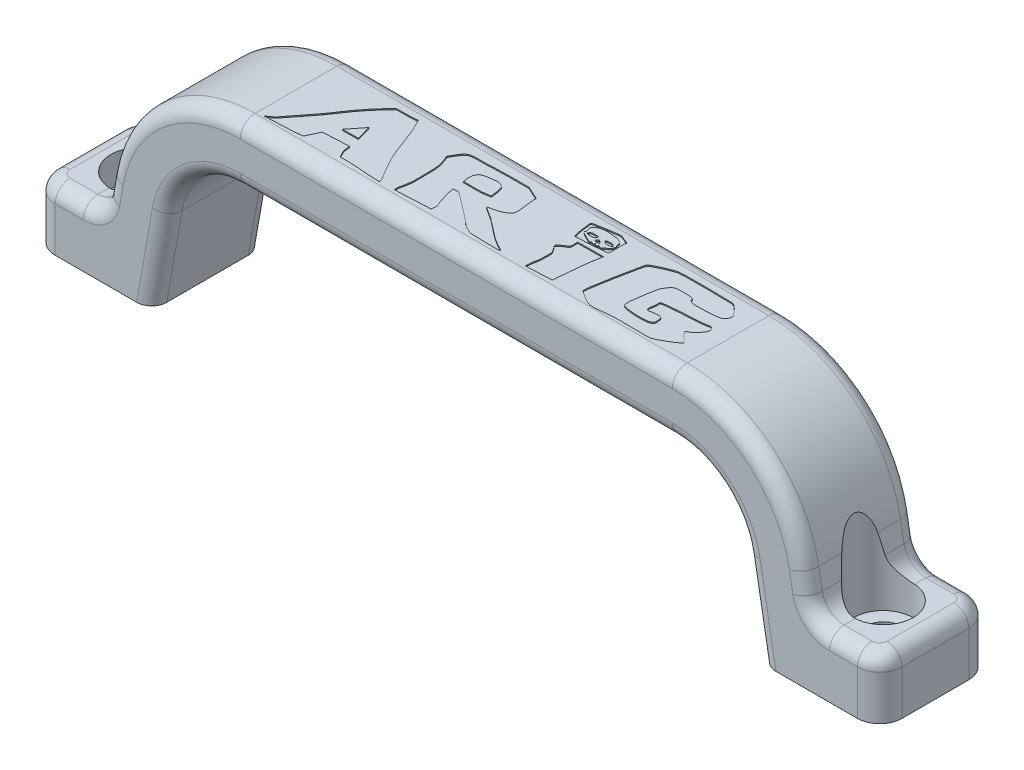
from build123d import *

# Parameters (mm, degrees)
EXTRU_MINCE1_DEPTH                           = 7.5
CONG_1_R                                     = 3
CONG_2_R                                     = 2
CHAMBRAGE_POUR_VIS_T_TE_CYLINDRIQUE_AT_COUNT = 2
CHAMBRAGE_POUR_VIS_T_TE_CYLINDRIQUE_AT_PITCH = 100
ENL_V_MAT_EXTRU_1_DEPTH                      = 0.15


with BuildPart() as part:
    # Esquisse1 → Extru.-Mince1 (new, symmetric)
    with BuildSketch(Plane.XY):
        with BuildLine():
            Line((-57, 0), (-41, 0))
            Line((-41, 0), (-38.930541604, 11.736481777))
            ThreePointArc((-38.930541604, 11.736481777), (-35.510340171, 17.660444431), (-29.082464074, 20))
            Line((-29.082464074, 20), (29.082464074, 20))
            ThreePointArc((29.082464074, 20), (35.510340171, 17.660444431), (38.930541604, 11.736481777))
            Line((38.930541604, 11.736481777), (41, 0))
            Line((41, 0), (57, 0))
            Line((57, 0), (57, 8))
            Line((57, 8), (47.712797049, 8))
            Line((47.712797049, 8), (46.809003628, 13.125667198))
            ThreePointArc((46.809003628, 13.125667198), (40.652641048, 23.788799976), (29.082464074, 28))
            Line((29.082464074, 28), (-29.082464074, 28))
            ThreePointArc((-29.082464074, 28), (-40.652641048, 23.788799976), (-46.809003628, 13.125667198))
            Line((-46.809003628, 13.125667198), (-47.712797049, 8))
            Line((-47.712797049, 8), (-57, 8))
            Line((-57, 8), (-57, 0))
        make_face()
    extrude(amount=EXTRU_MINCE1_DEPTH, both=True)

    # Congé1
    cong_1_edges = [part.edges().sort_by_distance(p)[0] for p in [
        (57, 4, -7.5),
        (-57, 4, -7.5),
        (-47.712797049, 8, 0),
        (47.712797049, 8, 0),
        (57, 4, 7.5),
        (-57, 4, 7.5),
    ]]
    fillet(cong_1_edges, radius=CONG_1_R)

    # Congé2
    cong_2_edges = [part.edges().sort_by_distance(p)[0] for p in [
        (-47.042338156, 11.802361333, -7.5),
        (-40.652641048, 23.788799976, -7.5),
        (0, 28, -7.5),
        (40.652641048, 23.788799976, -7.5),
        (-39.965270802, 5.868240888, 7.5),
        (39.965270802, 5.868240888, -7.5),
        (35.510340171, 17.660444431, -7.5),
        (0, 20, -7.5),
        (-35.510340171, 17.660444431, -7.5),
        (-39.965270802, 5.868240888, -7.5),
        (-35.510340171, 17.660444431, 7.5),
        (0, 20, 7.5),
        (35.510340171, 17.660444431, 7.5),
        (39.965270802, 5.868240888, 7.5),
        (40.652641048, 23.788799976, 7.5),
        (-52.115047971, 8, -7.5),
        (47.042338156, 11.802361333, -7.5),
        (52.115047971, 8, -7.5),
        (0, 28, 7.5),
        (57, 8, 0),
        (-40.652641048, 23.788799976, 7.5),
        (52.115047971, 8, 7.5),
        (56.121320344, 8, 6.621320344),
        (56.121320344, 8, -6.621320344),
        (-47.042338156, 11.802361333, 7.5),
        (-52.115047971, 8, 7.5),
        (47.042338156, 11.802361333, 7.5),
        (-57, 8, 0),
        (-56.121320344, 8, 6.621320344),
        (-56.121320344, 8, -6.621320344),
        (48.301733114, 8.701866671, -7.5),
        (48.301733114, 8.701866671, 7.5),
        (-48.301733114, 8.701866671, -7.5),
        (-48.301733114, 8.701866671, 7.5),
    ]]
    fillet(cong_2_edges, radius=CONG_2_R)

    # Esquisse4 → Chambrage pour vis à tête cylindrique à 6 pans creux (ou vis CHC) M41 (revolve, cut)
    with BuildSketch(Plane(origin=(-50, 8, 0), x_dir=(0, 0, 1), z_dir=(1, 0, 0))):
        Polygon((0, 0), (0, 8), (2.15, 8), (2.15, 4), (4, 4), (4, 0), (4, -20), (0, -20), align=None)
    chambrage_pour_vis_t_te_cylindrique = revolve(axis=Axis((-50, 14.35, 0), (0, -1, 0)), mode=Mode.SUBTRACT)

    # Chambrage pour vis à tête cylindrique à 6 pans creux (ou vis CHC) M41 at: Chambrage pour vis à tête cylindrique à 6 pans creux (ou vis CHC) M41 ×2
    with Locations(*[(i * CHAMBRAGE_POUR_VIS_T_TE_CYLINDRIQUE_AT_PITCH, 0, 0) for i in range(1, CHAMBRAGE_POUR_VIS_T_TE_CYLINDRIQUE_AT_COUNT)]):
        add(chambrage_pour_vis_t_te_cylindrique, mode=Mode.SUBTRACT)

    # Esquisse5 → Enlèv. mat.-Extru.1 (cut)
    # profile 1 of 8: a face of its own
    with BuildSketch(Plane(origin=(0, 28, 0), x_dir=(1, 0, 0), z_dir=(0, 1, 0))):
        with BuildLine():
            Line((-18.889000502, -2.985350745), (-22.376360288, -3.161141805))
            add(Edge.make_bspline(
                [(-22.376360288, -3.161141805), (-22.565625759, -3.549526321), (-22.776041372, -3.980343935), (-22.989652482, -4.455007498), (-23.04199279, -4.566720493), (-23.0850041, -4.661830805), (-23.120903649, -4.739872839), (-23.148036624, -4.800508414), (-23.17080172, -4.846101774), (-23.182038656, -4.872014531), (-23.186673363, -4.883894191)],
                knots=[0, 0, 0, 0, 0.680866466, 0.755242837, 0.820159886, 0.875250847, 0.919716623, 0.955522374, 0.979907426, 1, 1, 1, 1], degree=3))
            add(Edge.make_bspline(
                [(-23.186673363, -4.883894191), (-23.198861764, -4.88618144), (-23.227460591, -4.889107877), (-23.277705453, -4.896277084), (-23.343919737, -4.907097592), (-23.428436847, -4.91765227), (-23.531962497, -4.934092105), (-23.654456265, -4.949431501), (-23.840397148, -4.9772533), (-24.079565436, -5.00765737), (-24.448479708, -5.039071283), (-24.719360216, -5.054687273), (-24.896032145, -5.052988448)],
                knots=[0, 0, 0, 0, 0.021623909, 0.05012945, 0.088551735, 0.138677592, 0.19871818, 0.271429204, 0.354052996, 0.526763296, 0.691970711, 1, 1, 1, 1], degree=3))
            add(Edge.make_bspline(
                [(-24.896032145, -5.052988448), (-24.99927661, -5.05412406), (-25.16843858, -5.055868841), (-25.412805009, -5.065206566), (-25.638874799, -5.072843474), (-25.892737565, -5.085417568), (-26.17517873, -5.098165468), (-26.485405173, -5.115532657), (-26.812442031, -5.133190284), (-27.131123786, -5.150619117), (-27.417908194, -5.16787577), (-27.660109981, -5.181313798), (-27.858259626, -5.191200289), (-28.012322667, -5.198984075), (-28.129981574, -5.207305322), (-28.196501152, -5.209387023), (-28.226017077, -5.212037502)],
                knots=[0, 0, 0, 0, 0.092911413, 0.152199614, 0.220036878, 0.296445175, 0.380902634, 0.474438159, 0.576023544, 0.675603345, 0.761618374, 0.834541433, 0.89387215, 0.940138491, 0.973341463, 1, 1, 1, 1], degree=3))
            add(Edge.make_bspline(
                [(-28.226017077, -5.212037502), (-28.084104228, -5.126243217), (-27.880770234, -4.993968158), (-27.625169539, -4.809475629), (-27.456898151, -4.671894814), (-27.302747901, -4.536139114), (-27.166389152, -4.399171252), (-27.043710789, -4.263258786), (-26.903678064, -4.076487785), (-26.73406485, -3.836934967), (-26.435935045, -3.441472898), (-26.197088808, -3.145780455), (-26.032814331, -2.945169931)],
                knots=[0, 0, 0, 0, 0.156250484, 0.228517648, 0.296937377, 0.361008631, 0.421996837, 0.478992725, 0.53337618, 0.641834957, 0.755643392, 1, 1, 1, 1], degree=3))
            add(Edge.make_bspline(
                [(-26.032814331, -2.945169931), (-25.576080015, -2.391018303), (-24.911636831, -1.542011065), (-24.073936806, -0.373037195), (-23.573153724, 0.375322842), (-23.175994991, 0.977555252), (-22.86118328, 1.419690235), (-22.536729869, 1.855639722), (-22.203764498, 2.287110108), (-21.857996734, 2.710718389), (-21.382986603, 3.269269181), (-21.009905865, 3.67510356), (-20.757408338, 3.94249121)],
                knots=[0, 0, 0, 0, 0.248040936, 0.372250335, 0.496660753, 0.559052203, 0.62141506, 0.684102398, 0.746758016, 0.809648928, 0.872959115, 1, 1, 1, 1], degree=3))
            Line((-20.757408338, 3.94249121), (-20.161392935, 4.568642223))
            add(Edge.make_bspline(
                [(-20.161392935, 4.568642223), (-19.955451301, 4.566805976), (-19.621742428, 4.571775301), (-19.143475211, 4.575328653), (-18.726556757, 4.579363262), (-18.308528829, 4.589187745), (-17.826232066, 4.605914999), (-17.489194558, 4.633626348), (-17.281767956, 4.659049054)],
                knots=[0, 0, 0, 0, 0.214327974, 0.34734057, 0.497782751, 0.648255201, 0.782526155, 1, 1, 1, 1], degree=3))
            add(Edge.make_bspline(
                [(-17.281767956, 4.659049054), (-17.134949628, 4.393109456), (-16.91872931, 3.985901788), (-16.652834934, 3.423622362), (-16.45303627, 2.984506426), (-16.261320087, 2.530085326), (-16.072800605, 2.062932493), (-15.893093954, 1.580368816), (-15.718592326, 1.091178203), (-15.550147368, 0.609047261), (-15.381012558, 0.150831027), (-15.216067031, -0.277592451), (-15.052770633, -0.67577163), (-14.894620185, -1.044303975), (-14.697935731, -1.48006666), (-14.540010862, -1.785646), (-14.435626988, -1.979156203)],
                knots=[0, 0, 0, 0, 0.126040248, 0.191178203, 0.25801108, 0.326168609, 0.395773161, 0.466985195, 0.539776951, 0.611245197, 0.678854338, 0.742401129, 0.801689367, 0.857382442, 0.90877165, 1, 1, 1, 1], degree=3))
            add(Edge.make_bspline(
                [(-14.435626988, -1.979156203), (-14.060714152, -2.690732887), (-13.601110971, -3.46118765), (-13.093789638, -4.295915495), (-12.974550315, -4.503343512), (-12.880354646, -4.679202915), (-12.809833429, -4.82244348), (-12.766212787, -4.936621738), (-12.744331027, -5.029574258), (-12.7524512, -5.096469144), (-12.79323623, -5.098191863)],
                knots=[0, 0, 0, 0, 0.673145369, 0.751124796, 0.817898028, 0.873508092, 0.918030393, 0.951887101, 0.974708939, 1, 1, 1, 1], degree=3))
            add(Edge.make_bspline(
                [(-12.79323623, -5.098191863), (-12.846717709, -5.102791423), (-12.9416692, -5.101553031), (-13.087370306, -5.100362786), (-13.24025565, -5.094367844), (-13.422743659, -5.087855253), (-13.634850117, -5.07977698), (-13.876496627, -5.067919981), (-14.138710986, -5.052561348), (-14.405594289, -5.039085897), (-14.659457131, -5.021814653), (-14.892738065, -5.00517704), (-15.104830422, -4.988654402), (-15.296230366, -4.971686682), (-15.509841406, -4.951819794), (-15.65912897, -4.931158059), (-15.751548636, -4.917378202)],
                knots=[0, 0, 0, 0, 0.054222972, 0.096001359, 0.147400702, 0.208974939, 0.28072468, 0.362111732, 0.453705198, 0.546425989, 0.632418718, 0.711089977, 0.783006086, 0.847608632, 0.905465865, 1, 1, 1, 1], degree=3))
            add(Edge.make_bspline(
                [(-15.751548636, -4.917378202), (-15.841680449, -4.905421272), (-15.98562493, -4.891003038), (-16.188989069, -4.87646378), (-16.36699633, -4.866115105), (-16.562932828, -4.859496313), (-16.776163347, -4.857440088), (-17.006624055, -4.852668912), (-17.245496295, -4.853980892), (-17.47708963, -4.853942789), (-17.684698568, -4.853022364), (-17.860478285, -4.855917477), (-18.004464975, -4.855341731), (-18.116635899, -4.855448082), (-18.202020217, -4.855429658), (-18.25001395, -4.855433192), (-18.271220492, -4.855432781)],
                knots=[0, 0, 0, 0, 0.108137987, 0.17203399, 0.242511649, 0.320224082, 0.40520354, 0.496156706, 0.594402213, 0.689328615, 0.771642418, 0.841346783, 0.898435388, 0.942911395, 0.974774802, 1, 1, 1, 1], degree=3))
            add(Edge.make_bspline(
                [(-18.271220492, -4.855432781), (-18.278027736, -4.844649758), (-18.290567753, -4.819615634), (-18.314441824, -4.776018784), (-18.346489114, -4.71953322), (-18.386248728, -4.645328967), (-18.43650014, -4.55580176), (-18.495267105, -4.449861109), (-18.582078765, -4.292743887), (-18.68158196, -4.097085998), (-18.791714108, -3.817167413), (-18.82814295, -3.610495481), (-18.822032479, -3.482588314)],
                knots=[0, 0, 0, 0, 0.025534032, 0.056060285, 0.099620315, 0.155674132, 0.224761645, 0.305363743, 0.398459664, 0.584520463, 0.744872781, 1, 1, 1, 1], degree=3))
            add(Edge.make_bspline(
                [(-18.822032479, -3.482588314), (-18.820973275, -3.417333622), (-18.843820609, -3.251240918), (-18.867028843, -3.0855507), (-18.889000502, -2.985350745)],
                knots=[0, 0, 0, 0, 0.388377336, 1, 1, 1, 1], degree=3))
        make_face()
        with BuildLine():
            Line((-21.341704336, -1.465176628), (-19.227189017, -1.443412021))
            add(Edge.make_bspline(
                [(-19.227189017, -1.443412021), (-19.321779754, -1.071084197), (-19.441619334, -0.613903941), (-19.596246753, -0.085688012), (-19.676193266, 0.194654727), (-19.738523082, 0.38810815), (-19.778001005, 0.507031642)],
                knots=[0, 0, 0, 0, 0.568584025, 0.699276774, 0.81454122, 1, 1, 1, 1], degree=3))
            add(Edge.make_bspline(
                [(-19.778001005, 0.507031642), (-19.938000901, 0.309121276), (-20.168990568, 0.018996939), (-20.467823651, -0.355697696), (-20.671043317, -0.61022718), (-20.858311275, -0.848596899), (-21.081607435, -1.130607423), (-21.239208658, -1.335872481), (-21.341704336, -1.465176628)],
                knots=[0, 0, 0, 0, 0.303339354, 0.44202356, 0.571254616, 0.691554213, 0.803335608, 1, 1, 1, 1], degree=3))
        make_face(mode=Mode.SUBTRACT)
    # profile 2 of 8: a face of its own
    with BuildSketch(Plane(origin=(0, 28, 0), x_dir=(1, 0, 0), z_dir=(0, 1, 0))):
        with BuildLine():
            Line((-2.003683241, 4.314163737), (-0.215637033, 3.495479658))
            add(Edge.make_bspline(
                [(-0.215637033, 3.495479658), (-0.242645561, 3.410362138), (-0.253650223, 3.260734699), (-0.242239394, 3.040051999), (-0.205023193, 2.750428367), (-0.143755054, 2.354227592), (-0.078794271, 1.860419693), (-0.021328557, 1.364768653), (0.004380791, 0.963938143), (0.006318116, 0.669983637), (-0.017925261, 0.441928992), (-0.070217426, 0.291457638), (-0.125230203, 0.212372342)],
                knots=[0, 0, 0, 0, 0.079958746, 0.134412926, 0.199323326, 0.343348876, 0.496285098, 0.648796927, 0.793602404, 0.858577257, 0.913865917, 1, 1, 1, 1], degree=3))
            add(Edge.make_bspline(
                [(-0.125230203, 0.212372342), (-0.172462729, 0.147825454), (-0.256546762, 0.055919836), (-0.388602041, -0.051689738), (-0.504620223, -0.130197259), (-0.630714979, -0.209589541), (-0.772789325, -0.282962684), (-0.927909153, -0.352571038), (-1.153706025, -0.442234621), (-1.453395941, -0.545444724), (-1.964598352, -0.694803382), (-2.361852392, -0.783284359), (-2.633182655, -0.832328813)],
                knots=[0, 0, 0, 0, 0.086643666, 0.134367777, 0.184384294, 0.238452904, 0.295829646, 0.357573776, 0.422742128, 0.559179035, 0.701056708, 1, 1, 1, 1], degree=3))
            add(Edge.make_bspline(
                [(-2.633182655, -0.832328813), (-2.355731393, -0.991138943), (-1.946857331, -1.236333821), (-1.416494635, -1.579430382), (-1.033222794, -1.842948955), (-0.659738995, -2.110797867), (-0.296094575, -2.383269999), (0.056265765, -2.662906296), (0.396242371, -2.951788782), (0.738098315, -3.238266406), (1.093770146, -3.512325833), (1.461451409, -3.77848014), (1.842274178, -4.034438587), (2.234473284, -4.282775799), (2.777997858, -4.603961922), (3.199601867, -4.826954999), (3.486020425, -4.96927842)],
                knots=[0, 0, 0, 0, 0.129562826, 0.193176436, 0.255974622, 0.318051402, 0.379435805, 0.440120776, 0.500326732, 0.5602431, 0.620865236, 0.682259223, 0.744174686, 0.806797486, 0.870374094, 1, 1, 1, 1], degree=3))
            add(Edge.make_bspline(
                [(3.486020425, -4.96927842), (3.428753262, -4.993837788), (3.325339329, -5.019667503), (3.16770825, -5.038242518), (3.009565529, -5.049060828), (2.824255953, -5.058240697), (2.611523283, -5.057998515), (2.371494059, -5.057742268), (2.105910939, -5.047468209), (1.817966225, -5.037783024), (1.512174334, -5.027172755), (1.189577323, -5.01940673), (0.850833909, -5.010926656), (0.494787171, -5.002534928), (-0.01248366, -4.99130861), (-0.401439124, -4.982536856), (-0.665996986, -4.979323623)],
                knots=[0, 0, 0, 0, 0.044780014, 0.076413176, 0.114330404, 0.159026646, 0.210115369, 0.26764009, 0.33203326, 0.401666244, 0.475319553, 0.552579838, 0.634263575, 0.71956661, 0.809293345, 1, 1, 1, 1], degree=3))
            add(Edge.make_bspline(
                [(-0.665996986, -4.979323623), (-0.677902774, -4.972947866), (-0.70650434, -4.961628708), (-0.756087043, -4.93733398), (-0.822498977, -4.908425409), (-0.907229069, -4.869142038), (-1.009864595, -4.820392413), (-1.132984149, -4.765990274), (-1.26835005, -4.702395571), (-1.407253763, -4.637542789), (-1.536584612, -4.570096197), (-1.652377655, -4.505085498), (-1.754669507, -4.441507201), (-1.843672016, -4.380342599), (-1.937032783, -4.304141725), (-1.996253372, -4.24361585), (-2.027122049, -4.200820358)],
                knots=[0, 0, 0, 0, 0.02560566, 0.05830671, 0.104770837, 0.163070344, 0.235575693, 0.320438053, 0.418541203, 0.519463335, 0.611377807, 0.695336218, 0.771465269, 0.839935133, 0.900156543, 1, 1, 1, 1], degree=3))
            add(Edge.make_bspline(
                [(-2.027122049, -4.200820358), (-2.045918494, -4.178997931), (-2.079379926, -4.140840573), (-2.138353121, -4.090496062), (-2.198379267, -4.036684576), (-2.269609937, -3.972614952), (-2.356358376, -3.902775413), (-2.454241957, -3.822567827), (-2.605292234, -3.701921825), (-2.810071983, -3.536966065), (-3.075369779, -3.329772431), (-3.361544105, -3.106956272), (-3.776323554, -2.787186736), (-4.321775113, -2.369299651), (-4.881399603, -1.953168805), (-5.326923041, -1.621560415), (-5.729329419, -1.3172602), (-6.025047825, -1.104043184), (-6.210949272, -0.962916457)],
                knots=[0, 0, 0, 0, 0.016345481, 0.028665675, 0.043901598, 0.062053437, 0.082952022, 0.107010959, 0.133786167, 0.192523562, 0.256055589, 0.324580745, 0.398100161, 0.552912195, 0.714045099, 0.793378036, 0.867712912, 1, 1, 1, 1], degree=3))
            add(Edge.make_bspline(
                [(-6.210949272, -0.962916457), (-6.593840623, -0.972017884), (-6.976058932, -0.996400469)],
                knots=[0, 0, 0, 1, 1, 1], degree=2))
            add(Edge.make_bspline(
                [(-6.976058932, -0.996400469), (-6.923676683, -1.241695084), (-6.837373659, -1.626375055), (-6.693401156, -2.157160378), (-6.59368103, -2.519572534), (-6.508262889, -2.809468621), (-6.446388593, -3.00800643), (-6.389607825, -3.183861108), (-6.337829799, -3.337028612), (-6.29007465, -3.467465893), (-6.235812304, -3.59590063), (-6.195373901, -3.679795432), (-6.165745856, -3.725347397)],
                knots=[0, 0, 0, 0, 0.263801582, 0.414408358, 0.578294401, 0.659070143, 0.732204151, 0.796974333, 0.853392196, 0.902228584, 0.942993102, 1, 1, 1, 1], degree=3))
            add(Edge.make_bspline(
                [(-6.165745856, -3.725347397), (-6.104841856, -3.814269448), (-6.050517533, -3.973780142), (-6.025963142, -4.205017551), (-6.03822307, -4.361880313), (-6.050950421, -4.486648565), (-6.062165315, -4.569560848), (-6.067851453, -4.640658692), (-6.074693191, -4.698628225), (-6.080510095, -4.743735733), (-6.08210731, -4.778080998), (-6.087831477, -4.796661064), (-6.08705843, -4.805206764)],
                knots=[0, 0, 0, 0, 0.288847176, 0.450004935, 0.627168978, 0.713842629, 0.789996859, 0.853798141, 0.907070913, 0.948152535, 0.977043752, 1, 1, 1, 1], degree=3))
            add(Edge.make_bspline(
                [(-6.08705843, -4.805206764), (-6.099892989, -4.805263202), (-6.129488472, -4.804764508), (-6.181916752, -4.807425717), (-6.251128021, -4.808652456), (-6.339301531, -4.810404067), (-6.447566336, -4.812128074), (-6.575381471, -4.813303862), (-6.768469016, -4.818263485), (-7.011833295, -4.82445492), (-7.368964692, -4.837926889), (-7.624405065, -4.860563701), (-7.786372007, -4.878871589)],
                knots=[0, 0, 0, 0, 0.022629069, 0.05216164, 0.092512413, 0.144666941, 0.207642473, 0.28340705, 0.370010196, 0.548159068, 0.712610067, 1, 1, 1, 1], degree=3))
            add(Edge.make_bspline(
                [(-7.786372007, -4.878871589), (-7.877175647, -4.889390604), (-8.024483649, -4.903243761), (-8.235554594, -4.919883926), (-8.426434467, -4.933028382), (-8.638999019, -4.947062129), (-8.873526358, -4.957335186), (-9.129549823, -4.972278133), (-9.398654798, -4.982028631), (-9.663644564, -4.994940262), (-9.907066411, -5.00165973), (-10.120714213, -5.011536358), (-10.304919573, -5.015961848), (-10.459502444, -5.019517993), (-10.606280769, -5.021586093), (-10.701179478, -5.02168551), (-10.754729617, -5.019504437)],
                knots=[0, 0, 0, 0, 0.092244756, 0.149305596, 0.213667706, 0.285335221, 0.364280999, 0.450567525, 0.544140957, 0.636026333, 0.718300987, 0.789882146, 0.851856616, 0.904245849, 0.945926074, 1, 1, 1, 1], degree=3))
            add(Edge.make_bspline(
                [(-10.754729617, -5.019504437), (-10.793687745, -5.018544082), (-10.83361451, -4.965453672), (-10.85216044, -4.871033306), (-10.85544645, -4.763171373), (-10.845319364, -4.625686994), (-10.825236126, -4.458519001), (-10.790624976, -4.261522518), (-10.744512468, -4.042686549), (-10.694591845, -3.815632725), (-10.651152469, -3.59457601), (-10.614499462, -3.388025877), (-10.583843881, -3.196086144), (-10.56023359, -3.018573172), (-10.538774618, -2.810565067), (-10.530495985, -2.661275821), (-10.53038674, -2.566800603)],
                knots=[0, 0, 0, 0, 0.040959665, 0.071715244, 0.114252125, 0.168793839, 0.235661122, 0.314465282, 0.406650774, 0.501708187, 0.591028112, 0.67463858, 0.751261936, 0.822247522, 0.887648532, 1, 1, 1, 1], degree=3))
            add(Edge.make_bspline(
                [(-10.53038674, -2.566800603), (-10.542925443, -2.138277151), (-10.551851525, -1.509323921), (-10.564649317, -0.688367667), (-10.559941923, -0.201094049), (-10.570824166, 0.184482141), (-10.59944928, 0.478732364), (-10.649520811, 0.781334256), (-10.715066406, 1.092714539), (-10.806273828, 1.41067768), (-10.948681417, 1.856506074), (-11.084215704, 2.188291418), (-11.183324962, 2.41059769)],
                knots=[0, 0, 0, 0, 0.253586485, 0.372108987, 0.485672727, 0.541829048, 0.600201593, 0.660390498, 0.723197736, 0.788316244, 0.855967059, 1, 1, 1, 1], degree=3))
            add(Edge.make_bspline(
                [(-11.183324962, 2.41059769), (-11.174365219, 2.426205781), (-11.154787121, 2.461102922), (-11.117901251, 2.522370431), (-11.072361264, 2.604063497), (-11.010936644, 2.707437688), (-10.940373315, 2.835581277), (-10.851351037, 2.984243917), (-10.756711941, 3.152654259), (-10.652620423, 3.322210559), (-10.549991567, 3.482419102), (-10.446127794, 3.623007556), (-10.343712114, 3.745922269), (-10.243797068, 3.85187549), (-10.117884959, 3.964727719), (-10.014889586, 4.028372577), (-9.946090742, 4.061359451)],
                knots=[0, 0, 0, 0, 0.025827939, 0.057419994, 0.102618887, 0.160037757, 0.229972504, 0.312526395, 0.40868662, 0.507170089, 0.598024387, 0.681639799, 0.757829693, 0.827507157, 0.890492998, 1, 1, 1, 1], degree=3))
            add(Edge.make_bspline(
                [(-9.946090742, 4.061359451), (-9.873558418, 4.093656607), (-9.750572742, 4.128721891), (-9.571907885, 4.164582637), (-9.409120143, 4.185740781), (-9.226930944, 4.199840095), (-9.024847859, 4.210361251), (-8.803168569, 4.212841184), (-8.567098449, 4.210613953), (-8.328265029, 4.206796683), (-8.098331524, 4.204711959), (-7.882892484, 4.206421663), (-7.682494976, 4.211045875), (-7.496133051, 4.220052455), (-7.277035529, 4.231612845), (-7.120421927, 4.247864314), (-7.021262347, 4.258915118)],
                knots=[0, 0, 0, 0, 0.080681971, 0.129987049, 0.185653492, 0.24786317, 0.31620388, 0.391862218, 0.473770726, 0.556822641, 0.635318464, 0.708126493, 0.776403264, 0.839603571, 0.898288811, 1, 1, 1, 1], degree=3))
            add(Edge.make_bspline(
                [(-7.021262347, 4.258915118), (-6.964945496, 4.263796032), (-6.871883328, 4.272551288), (-6.736044813, 4.277003691), (-6.608920952, 4.284976738), (-6.464338708, 4.289669363), (-6.303005919, 4.291901646), (-6.124481138, 4.298289105), (-5.723747593, 4.303383807), (-5.096538625, 4.314791282), (-4.392767481, 4.316553248), (-3.831912399, 4.319714745), (-3.430660666, 4.318814079), (-3.052845005, 4.320107373), (-2.7548458, 4.316787311), (-2.536629736, 4.318231024), (-2.397125579, 4.315430252), (-2.278813189, 4.31562449), (-2.182248678, 4.316675283), (-2.107494836, 4.313741122), (-2.050559849, 4.314252135), (-2.018193096, 4.314153537), (-2.003683241, 4.314163737)],
                knots=[0, 0, 0, 0, 0.03379881, 0.055838388, 0.081226209, 0.109932276, 0.142297245, 0.177671792, 0.216707356, 0.381850208, 0.552650487, 0.63738264, 0.717110308, 0.792501324, 0.863222887, 0.89524739, 0.92293725, 0.946622039, 0.965970176, 0.980651863, 0.991326697, 1, 1, 1, 1], degree=3))
        make_face()
        with BuildLine():
            add(Edge.make_bspline(
                [(-4.759417378, 2.879373849), (-4.781302606, 2.877593765), (-4.830727327, 2.86948708), (-4.919031971, 2.859885662), (-5.035168627, 2.846449039), (-5.183503472, 2.827661333), (-5.365425503, 2.805828258), (-5.580413257, 2.781237227), (-5.818966512, 2.752605124), (-6.061163536, 2.719715256), (-6.286313254, 2.671554459), (-6.484133476, 2.611932369), (-6.656830094, 2.541941072), (-6.801863812, 2.458854845), (-6.958650643, 2.339722526), (-7.041338246, 2.222687295), (-7.076510966, 2.139377197)],
                knots=[0, 0, 0, 0, 0.02605756, 0.059426763, 0.105454527, 0.164877345, 0.236957987, 0.323013216, 0.421805132, 0.522263015, 0.613111039, 0.694859303, 0.767340869, 0.833832102, 0.892821077, 1, 1, 1, 1], degree=3))
            add(Edge.make_bspline(
                [(-7.076510966, 2.139377197), (-7.143425727, 1.980344281), (-7.208988247, 1.728212305), (-7.224895381, 1.382771148), (-7.204453242, 1.169480386), (-7.175674334, 1.008297489), (-7.159766967, 0.902034185), (-7.144044511, 0.812385177), (-7.132992121, 0.738514798), (-7.122785878, 0.681718501), (-7.114724914, 0.638305746), (-7.112566185, 0.613473849), (-7.109994977, 0.602461075)],
                knots=[0, 0, 0, 0, 0.330717255, 0.494743274, 0.66141552, 0.740643754, 0.808957971, 0.86758672, 0.915300905, 0.952275666, 0.978332888, 1, 1, 1, 1], degree=3))
            add(Edge.make_bspline(
                [(-7.109994977, 0.602461075), (-7.08821406, 0.602826701), (-7.03969765, 0.600073717), (-6.953179364, 0.598968688), (-6.839320892, 0.597529315), (-6.693128316, 0.593629396), (-6.514543225, 0.590411969), (-6.303574183, 0.587615703), (-6.068661803, 0.581829119), (-5.827563107, 0.578883697), (-5.598196833, 0.577248731), (-5.388901129, 0.576526905), (-5.200262924, 0.580223762), (-5.032833138, 0.585162542), (-4.850607854, 0.592637051), (-4.724555814, 0.604467298), (-4.64724594, 0.614180479)],
                knots=[0, 0, 0, 0, 0.026507731, 0.059125295, 0.10532848, 0.165129813, 0.237157457, 0.322770769, 0.42198194, 0.523219447, 0.616297692, 0.701220837, 0.778003383, 0.845972464, 0.905141411, 1, 1, 1, 1], degree=3))
            add(Edge.make_bspline(
                [(-4.64724594, 0.614180479), (-4.401916162, 0.649092875), (-4.103451836, 0.683420048), (-3.77016207, 0.73665676), (-3.651517713, 0.751623803), (-3.585233291, 0.761996391), (-3.555667169, 0.766532731)],
                knots=[0, 0, 0, 0, 0.674542705, 0.817400396, 0.918581502, 1, 1, 1, 1], degree=3))
            add(Edge.make_bspline(
                [(-3.555667169, 0.766532731), (-3.558111653, 0.779259332), (-3.560565186, 0.808476289), (-3.56859981, 0.859642773), (-3.576608519, 0.927223314), (-3.586388304, 1.014376716), (-3.599769925, 1.120976654), (-3.617088376, 1.246392549), (-3.640375161, 1.437169485), (-3.677042219, 1.681627225), (-3.747122546, 2.055584682), (-3.824981267, 2.32379433), (-3.88213628, 2.495981919)],
                knots=[0, 0, 0, 0, 0.022023902, 0.049814417, 0.088082161, 0.137773587, 0.199001978, 0.270830004, 0.353135428, 0.525922141, 0.691248609, 1, 1, 1, 1], degree=3))
            add(Edge.make_bspline(
                [(-3.88213628, 2.495981919), (-3.941333776, 2.568052304), (-4.060601502, 2.652350118), (-4.243858474, 2.740147924), (-4.40171702, 2.784404075), (-4.545270952, 2.824494869), (-4.663784512, 2.85293103), (-4.729455006, 2.87307835), (-4.759417378, 2.879373849)],
                knots=[0, 0, 0, 0, 0.284229272, 0.44586576, 0.624361782, 0.788398133, 0.905664888, 1, 1, 1, 1], degree=3))
        make_face(mode=Mode.SUBTRACT)
    # profile 3 of 8: a face of its own
    with BuildSketch(Plane(origin=(0, 28, 0), x_dir=(1, 0, 0), z_dir=(0, 1, 0))):
        with BuildLine():
            Line((7.630671354, 1.20684748), (11.096266533, 1.240331492))
            add(Edge.make_bspline(
                [(11.096266533, 1.240331492), (11.09486103, 1.224880522), (11.083784644, 1.191078844), (11.073781894, 1.129075836), (11.056126692, 1.048906583), (11.033739036, 0.945905848), (11.010249506, 0.819220405), (10.976688467, 0.670250695), (10.944055093, 0.503538588), (10.907702824, 0.333131032), (10.875453866, 0.16967822), (10.849220769, 0.019347065), (10.82555535, -0.117902633), (10.805616798, -0.241820587), (10.783763372, -0.380357327), (10.773497996, -0.478298731), (10.769797422, -0.539343713)],
                knots=[0, 0, 0, 0, 0.025603395, 0.058610901, 0.103952333, 0.161629351, 0.23326675, 0.31742479, 0.414634386, 0.514747692, 0.606153813, 0.690686995, 0.767614393, 0.836940395, 0.898671008, 1, 1, 1, 1], degree=3))
            add(Edge.make_bspline(
                [(10.769797422, -0.539343713), (10.763465565, -0.576509466), (10.758342209, -0.642117458), (10.745168185, -0.740114901), (10.735869125, -0.840155909), (10.724096513, -0.956224846), (10.710423426, -1.090134107), (10.695735673, -1.240849651), (10.660406081, -1.589461631), (10.610217985, -2.142726495), (10.550146353, -2.76762204), (10.504268257, -3.271090789), (10.471107929, -3.634476988), (10.43706145, -3.977580846), (10.411415184, -4.24947305), (10.389745118, -4.448491615), (10.379482005, -4.575987277), (10.366586919, -4.682903077), (10.358435663, -4.770601118), (10.35238637, -4.839303841), (10.345386349, -4.891589955), (10.345683083, -4.921472529), (10.342876277, -4.934120208)],
                knots=[0, 0, 0, 0, 0.025587132, 0.044680923, 0.067166483, 0.093839752, 0.123946238, 0.158617736, 0.196722407, 0.362008612, 0.536048073, 0.623239034, 0.705486973, 0.783960285, 0.857491068, 0.891030809, 0.919968607, 0.944379282, 0.964186309, 0.979805497, 0.991236898, 1, 1, 1, 1], degree=3))
            Line((10.342876277, -4.934120208), (6.867235895, -5.104888666))
            add(Edge.make_bspline(
                [(6.867235895, -5.104888666), (6.86661132, -5.092506941), (6.872030917, -5.065394411), (6.873743748, -5.016656588), (6.880108548, -4.953177466), (6.883522086, -4.870944557), (6.89353879, -4.770696729), (6.900894977, -4.651709916), (6.913664061, -4.47689111), (6.932738428, -4.269537632), (6.964580834, -4.013522637), (6.999370107, -3.848185364), (7.034655952, -3.758831408)],
                knots=[0, 0, 0, 0, 0.027227541, 0.060557089, 0.107482734, 0.167917376, 0.242036699, 0.329658068, 0.430874444, 0.628706928, 0.788886053, 1, 1, 1, 1], degree=3))
            add(Edge.make_bspline(
                [(7.034655952, -3.758831408), (7.049715707, -3.7193842), (7.066317385, -3.649589708), (7.078934913, -3.543504317), (7.091164156, -3.438680618), (7.100728512, -3.316373694), (7.10908963, -3.176836297), (7.11558983, -3.019431657), (7.120404766, -2.849761473), (7.123114791, -2.679524447), (7.126603403, -2.520478407), (7.129782089, -2.378165632), (7.133477246, -2.25262467), (7.135670452, -2.143794298), (7.134085664, -2.032155951), (7.13798212, -1.956852726), (7.136782187, -1.91218818)],
                knots=[0, 0, 0, 0, 0.068225213, 0.115621998, 0.172881919, 0.239047274, 0.314159471, 0.399149207, 0.494037421, 0.588904133, 0.674739369, 0.751543555, 0.819317288, 0.878040598, 0.927723673, 1, 1, 1, 1], degree=3))
            add(Edge.make_bspline(
                [(7.136782187, -1.91218818), (7.134522646, -1.828705005), (7.09265768, -1.694126745), (6.995909593, -1.511475036), (6.894226072, -1.34829751), (6.78671526, -1.185593974), (6.657593634, -1.009184797), (6.568652925, -0.888058054), (6.507282772, -0.820609409)],
                knots=[0, 0, 0, 0, 0.194515717, 0.327212743, 0.485727507, 0.646670228, 0.785858904, 1, 1, 1, 1], degree=3))
            add(Edge.make_bspline(
                [(6.507282772, -0.820609409), (6.484693472, -0.796082873), (6.469162979, -0.74432873), (6.484133913, -0.672275532), (6.514402629, -0.613687751), (6.561124268, -0.550841035), (6.626383099, -0.484204636), (6.707649518, -0.411010413), (6.836994582, -0.312552285), (6.997137026, -0.1974717), (7.2144428, -0.049148967), (7.366932905, 0.045205453), (7.463251298, 0.093504102)],
                knots=[0, 0, 0, 0, 0.069172522, 0.107801306, 0.153967178, 0.208312335, 0.273773002, 0.351909297, 0.440673071, 0.619149632, 0.771185017, 1, 1, 1, 1], degree=3))
            add(Edge.make_bspline(
                [(7.463251298, 0.093504102), (7.499395458, 0.114423212), (7.553345641, 0.15472004), (7.598516231, 0.234531168), (7.625984103, 0.306368554), (7.648772408, 0.389195274), (7.658650542, 0.48446479), (7.664256068, 0.591252407), (7.659650036, 0.705802335), (7.652300936, 0.818391039), (7.647931467, 0.920028513), (7.642940352, 1.005980944), (7.637687825, 1.076240498), (7.633838893, 1.130913577), (7.633108171, 1.172847122), (7.630283301, 1.196209554), (7.630671354, 1.20684748)],
                knots=[0, 0, 0, 0, 0.107361863, 0.165306111, 0.230947338, 0.302915333, 0.383032864, 0.473988459, 0.57482163, 0.674357307, 0.761058936, 0.83358483, 0.893360879, 0.940294377, 0.972976538, 1, 1, 1, 1], degree=3))
        make_face()
    # profile 4 of 8: a face of its own
    with BuildSketch(Plane(origin=(0, 28, 0), x_dir=(1, 0, 0), z_dir=(0, 1, 0))):
        with BuildLine():
            add(Edge.make_bspline(
                [(11.11803114, 4.394525364), (11.125830188, 4.388412657), (11.102577901, 4.361769552), (11.09530826, 4.319088153), (11.021834302, 4.170831839), (11.007032606, 4.028946306), (11.005859702, 3.907332998)],
                knots=[0, 0, 0, 0, 0.053978528, 0.146339813, 0.286106227, 1, 1, 1, 1], degree=3))
            add(Edge.make_bspline(
                [(11.005859702, 3.907332998), (11.00500545, 3.860439811), (11.007686795, 3.780657059), (11.009009623, 3.660651802), (11.012570912, 3.541221958), (11.01797371, 3.402296507), (11.022996423, 3.243803184), (11.027440659, 3.065744277), (11.034471584, 2.874935179), (11.040440871, 2.686321088), (11.039223596, 2.514288588), (11.031019863, 2.366208309), (11.018041833, 2.242175765), (11.001272716, 2.140569018), (10.971947481, 2.048323758), (10.940425976, 1.990936844), (10.905407668, 1.975305542)],
                knots=[0, 0, 0, 0, 0.071572732, 0.121845043, 0.183209154, 0.253967237, 0.334091377, 0.425285924, 0.52587385, 0.625584843, 0.713339901, 0.78843248, 0.851844173, 0.903813166, 0.945033847, 1, 1, 1, 1], degree=3))
            add(Edge.make_bspline(
                [(10.905407668, 1.975305542), (10.880127541, 1.967754381), (10.833599526, 1.956083143), (10.760246732, 1.948349382), (10.681679262, 1.937537246), (10.587510418, 1.925389293), (10.476210059, 1.916601238), (10.349650982, 1.90411622), (10.157079577, 1.888817412), (9.899796974, 1.869513375), (9.577882052, 1.845260595), (9.241760311, 1.824823547), (8.783176001, 1.793014899), (8.22225946, 1.758714717), (7.729510295, 1.728179571), (7.423034064, 1.711376322), (7.293063282, 1.702618904), (7.178665182, 1.695744112), (7.080393431, 1.691159867), (6.998331514, 1.686376771), (6.921417616, 1.67994206), (6.871728101, 1.676797786), (6.843797087, 1.67562364)],
                knots=[0, 0, 0, 0, 0.019443464, 0.035192924, 0.05425525, 0.077853516, 0.105085916, 0.136447842, 0.171494081, 0.247321464, 0.326427108, 0.409194118, 0.495268363, 0.664903198, 0.82297835, 0.858787174, 0.890904533, 0.918895232, 0.943170693, 0.963343358, 0.979416489, 1, 1, 1, 1], degree=3))
            add(Edge.make_bspline(
                [(6.843797087, 1.67562364), (6.792059301, 1.678135643), (6.741551572, 1.757587654), (6.683355218, 1.886594263), (6.618401992, 2.111606565), (6.541175524, 2.441044327), (6.464438398, 2.86823547), (6.399737831, 3.303852844), (6.355546512, 3.655218161), (6.330955515, 3.905609483), (6.315817297, 4.068516028), (6.306815654, 4.170059995), (6.304704504, 4.223756906)],
                knots=[0, 0, 0, 0, 0.05182692, 0.099087784, 0.162693256, 0.315467952, 0.483291731, 0.654026143, 0.814591578, 0.884502244, 0.939123223, 1, 1, 1, 1], degree=3))
            add(Edge.make_bspline(
                [(6.304704504, 4.223756906), (6.309721739, 4.254118004), (6.347513932, 4.290701981), (6.414064207, 4.329605551), (6.489095643, 4.361211623), (6.583589157, 4.390263683), (6.697386786, 4.420577007), (6.831038004, 4.448435207), (7.355150287, 4.537083731), (7.834726094, 4.615137697), (8.261844969, 4.694207266)],
                knots=[0, 0, 0, 0, 0.042498153, 0.074127563, 0.113412335, 0.161627293, 0.219285163, 0.286323671, 0.362058628, 1, 1, 1, 1], degree=3))
            add(Edge.make_bspline(
                [(8.261844969, 4.694207266), (8.456988582, 4.732062844), (8.734780644, 4.775750431), (9.082352971, 4.832591134), (9.294011883, 4.860861564), (9.473160509, 4.881575946), (9.646715659, 4.89577348), (9.760986587, 4.899338531), (9.825548301, 4.891762933)],
                knots=[0, 0, 0, 0, 0.377580033, 0.534295213, 0.669105456, 0.78327045, 0.876872935, 1, 1, 1, 1], degree=3))
            add(Edge.make_bspline(
                [(9.825548301, 4.891762933), (9.865335314, 4.884695114), (9.929792845, 4.866672132), (10.021594509, 4.835335246), (10.10814293, 4.8056425), (10.203984022, 4.766344361), (10.311972649, 4.722963652), (10.430440534, 4.673045898), (10.554634124, 4.617051248), (10.677392212, 4.564708838), (10.787808999, 4.515262199), (10.882844873, 4.475376725), (10.961498083, 4.443615393), (11.023291265, 4.419295788), (11.073530738, 4.403773688), (11.102886636, 4.392536854), (11.11803114, 4.394525364)],
                knots=[0, 0, 0, 0, 0.087260307, 0.144496275, 0.20975532, 0.285042318, 0.368396616, 0.461401885, 0.562967734, 0.662944262, 0.749931218, 0.824557791, 0.885728616, 0.933463399, 0.96780498, 1, 1, 1, 1], degree=3))
        make_face()
        with BuildLine():
            Line((8.328812992, 2.037250963), (8.474468441, 2.037250963))
            Line((8.474468441, 2.037250963), (8.531391261, 2.196300017))
            Line((8.531391261, 2.196300017), (8.745688934, 2.032228361))
            Line((8.745688934, 2.032228361), (9.003515821, 2.037250963))
            Line((9.003515821, 2.037250963), (8.958312406, 2.229784028))
            Line((8.958312406, 2.229784028), (9.239578101, 2.048970367))
            Line((9.239578101, 2.048970367), (9.453875774, 2.060689771))
            Line((9.453875774, 2.060689771), (9.386907752, 2.253222836))
            Line((9.386907752, 2.253222836), (9.756906077, 2.065712372))
            Line((9.756906077, 2.065712372), (9.992968358, 2.127657793))
            add(Edge.make_bspline(
                [(9.992968358, 2.127657793), (10.00958805, 2.144556333), (10.05619015, 2.188325358), (10.096956352, 2.239563029), (10.106813996, 2.280010045)],
                knots=[0, 0, 0, 0, 0.369096705, 1, 1, 1, 1], degree=3))
            add(Edge.make_bspline(
                [(10.106813996, 2.280010045), (10.108586516, 2.307124259), (10.145596853, 2.337379882), (10.204957228, 2.378884439), (10.276102214, 2.411015607), (10.349137151, 2.446604909), (10.429398732, 2.489484675), (10.481911574, 2.522236361), (10.510296334, 2.546207936)],
                knots=[0, 0, 0, 0, 0.150434797, 0.277872366, 0.445301547, 0.623391817, 0.77414725, 1, 1, 1, 1], degree=3))
            add(Edge.make_bspline(
                [(10.510296334, 2.546207936), (10.539981582, 2.578668556), (10.585321433, 2.642969315), (10.64726799, 2.748325299), (10.708964821, 2.854061011), (10.766942201, 2.965555151), (10.810451083, 3.099033389), (10.813740183, 3.197322838), (10.791562029, 3.252720576)],
                knots=[0, 0, 0, 0, 0.167592174, 0.299474164, 0.466458996, 0.635079847, 0.777913069, 1, 1, 1, 1], degree=3))
            add(Edge.make_bspline(
                [(10.791562029, 3.252720576), (10.751114773, 3.348168094), (10.677826642, 3.511915781), (10.628329247, 3.685532828), (10.624141972, 3.761677549)],
                knots=[0, 0, 0, 0, 0.577780049, 1, 1, 1, 1], degree=3))
            add(Edge.make_bspline(
                [(10.624141972, 3.761677549), (10.626740874, 3.814570034), (10.577991413, 3.936929208), (10.467648806, 4.0075839), (10.409844299, 4.049640047)],
                knots=[0, 0, 0, 0, 0.415543448, 1, 1, 1, 1], degree=3))
            add(Edge.make_bspline(
                [(10.409844299, 4.049640047), (10.365164699, 4.077256401), (10.28873305, 4.114869581), (10.177941381, 4.168069128), (10.080839573, 4.208551068), (9.992478208, 4.249226115), (9.918265017, 4.277873622), (9.877966294, 4.2975745), (9.859032312, 4.304118533)],
                knots=[0, 0, 0, 0, 0.259108223, 0.420683611, 0.60713931, 0.778754162, 0.901133521, 1, 1, 1, 1], degree=3))
            add(Edge.make_bspline(
                [(9.859032312, 4.304118533), (9.844605103, 4.306460714), (9.810982232, 4.309202505), (9.75194248, 4.31690718), (9.673791633, 4.325142329), (9.574338357, 4.334605943), (9.45218048, 4.348587058), (9.308251186, 4.365227569), (9.090334101, 4.389778402), (8.814329112, 4.415619703), (8.401113401, 4.43027822), (8.102297434, 4.420524785), (7.91193705, 4.394525364)],
                knots=[0, 0, 0, 0, 0.022425807, 0.051755527, 0.091397242, 0.143057438, 0.205121619, 0.28014791, 0.365486158, 0.541791589, 0.705536928, 1, 1, 1, 1], degree=3))
            add(Edge.make_bspline(
                [(7.91193705, 4.394525364), (7.747281302, 4.372957899), (7.509199004, 4.317508949), (7.230722552, 4.170814272), (7.088818142, 4.057552204), (6.993824519, 3.960964107), (6.932547157, 3.895380818), (6.882775944, 3.835660441), (6.842254886, 3.781884793), (6.816226766, 3.731594411), (6.793260608, 3.677850005), (6.791302042, 3.637195835), (6.798593672, 3.614347899)],
                knots=[0, 0, 0, 0, 0.344722863, 0.499299232, 0.6481903, 0.71846273, 0.779795834, 0.833948232, 0.879487626, 0.918777482, 0.950968327, 1, 1, 1, 1], degree=3))
            add(Edge.make_bspline(
                [(6.798593672, 3.614347899), (6.810350406, 3.56240569), (6.835626274, 3.479924397), (6.867725064, 3.360631893), (6.899548513, 3.25910208), (6.92622916, 3.157571047), (6.936241179, 3.038804445), (6.917488141, 2.956226302), (6.889000502, 2.91285786)],
                knots=[0, 0, 0, 0, 0.219895245, 0.356435236, 0.510405614, 0.659764159, 0.789246029, 1, 1, 1, 1], degree=3))
            add(Edge.make_bspline(
                [(6.889000502, 2.91285786), (6.87361213, 2.894291124), (6.866769616, 2.854652999), (6.888960844, 2.805326814), (6.920714662, 2.766648252), (6.967624943, 2.726271017), (7.02920378, 2.683871601), (7.105557519, 2.638587105), (7.22197092, 2.576546602), (7.366218294, 2.50783666), (7.554140068, 2.416039649), (7.679691034, 2.352375329), (7.754562197, 2.315168257)],
                knots=[0, 0, 0, 0, 0.063204014, 0.098953813, 0.14288004, 0.197211908, 0.265225551, 0.344153597, 0.43634066, 0.62064116, 0.7746751, 1, 1, 1, 1], degree=3))
            add(Edge.make_bspline(
                [(7.754562197, 2.315168257), (7.877726209, 2.252893115), (8.030665899, 2.176942295), (8.20675197, 2.095062682), (8.273807881, 2.062246396), (8.312440422, 2.045839248), (8.328812992, 2.037250963)],
                knots=[0, 0, 0, 0, 0.649001904, 0.802776351, 0.913114365, 1, 1, 1, 1], degree=3))
        make_face(mode=Mode.SUBTRACT)
    # profile 5 of 8: a face of its own
    with BuildSketch(Plane(origin=(0, 28, 0), x_dir=(1, 0, 0), z_dir=(0, 1, 0))):
        with BuildLine():
            add(Edge.make_bspline(
                [(8.44098443, 3.219236565), (8.435807987, 3.19659318), (8.426453266, 3.098704375), (8.379677474, 3.008594107), (8.350577599, 2.94131927)],
                knots=[0, 0, 0, 0, 0.237189797, 1, 1, 1, 1], degree=3))
            add(Edge.make_bspline(
                [(8.350577599, 2.94131927), (8.321651301, 2.884137303), (8.226449161, 2.830677631), (8.070393956, 2.797055308), (7.914858191, 2.78781389), (7.75400991, 2.784401458), (7.572170041, 2.788773195), (7.447327286, 2.797178787), (7.372844467, 2.812405826)],
                knots=[0, 0, 0, 0, 0.178437333, 0.306179726, 0.466999132, 0.633859722, 0.777827379, 1, 1, 1, 1], degree=3))
            add(Edge.make_bspline(
                [(7.372844467, 2.812405826), (7.332972903, 2.820276944), (7.248838669, 2.839642548), (7.227748186, 2.933887456), (7.253867115, 3.000238219), (7.295898699, 3.065852153), (7.368259851, 3.153229029), (7.445341601, 3.194756586), (7.496735309, 3.219236565)],
                knots=[0, 0, 0, 0, 0.235848172, 0.327074338, 0.442573336, 0.579188809, 0.714482119, 1, 1, 1, 1], degree=3))
            add(Edge.make_bspline(
                [(7.496735309, 3.219236565), (7.565842447, 3.245735042), (7.689862962, 3.264191386), (7.875244493, 3.264104129), (8.044442299, 3.254169956), (8.203168189, 3.238391412), (8.33446321, 3.228977982), (8.407980447, 3.221040846), (8.44098443, 3.219236565)],
                knots=[0, 0, 0, 0, 0.232105552, 0.392378004, 0.584631718, 0.766719213, 0.895715179, 1, 1, 1, 1], degree=3))
        make_face()
    # profile 6 of 8: a face of its own
    with BuildSketch(Plane(origin=(0, 28, 0), x_dir=(1, 0, 0), z_dir=(0, 1, 0))):
        with BuildLine():
            add(Edge.make_bspline(
                [(10.173782019, 3.338104805), (10.187174047, 3.331876099), (10.215235659, 3.314359696), (10.265469856, 3.284256365), (10.326078363, 3.24648363), (10.391826705, 3.206793224), (10.463997936, 3.158282167), (10.508832791, 3.119144287), (10.533735141, 3.093671522)],
                knots=[0, 0, 0, 0, 0.101407744, 0.227083837, 0.402775853, 0.592292657, 0.755113376, 1, 1, 1, 1], degree=3))
            add(Edge.make_bspline(
                [(10.533735141, 3.093671522), (10.551897899, 3.065423643), (10.51308699, 3.022415473), (10.437897532, 2.985944743), (10.231335658, 2.915076191), (10.039079452, 2.889153691), (9.880796919, 2.896115855)],
                knots=[0, 0, 0, 0, 0.10687177, 0.2067158, 0.350734942, 1, 1, 1, 1], degree=3))
            add(Edge.make_bspline(
                [(9.880796919, 2.896115855), (9.802809249, 2.895758955), (9.692051519, 2.914627478), (9.55630555, 2.963668361), (9.477268936, 3.015218293), (9.418243495, 3.071376252), (9.373630944, 3.147574096), (9.381890843, 3.212603058), (9.408672359, 3.241001172)],
                knots=[0, 0, 0, 0, 0.337586923, 0.485996123, 0.624790994, 0.745021554, 0.838467978, 1, 1, 1, 1], degree=3))
            add(Edge.make_bspline(
                [(9.408672359, 3.241001172), (9.441714165, 3.286437359), (9.533999957, 3.318226937), (9.678505087, 3.338649568), (9.822820482, 3.339834922), (9.962268517, 3.340637067), (10.07890596, 3.337589521), (10.1447626, 3.338168597), (10.173782019, 3.338104805)],
                knots=[0, 0, 0, 0, 0.202076727, 0.358791555, 0.5563159, 0.749491927, 0.889613699, 1, 1, 1, 1], degree=3))
        make_face()
    # profile 7 of 8: a face of its own
    with BuildSketch(Plane(origin=(0, 28, 0), x_dir=(1, 0, 0), z_dir=(0, 1, 0))):
        with BuildLine():
            Line((9.284781517, 2.512723924), (8.891344383, 2.439059099))
            add(Edge.make_bspline(
                [(8.891344383, 2.439059099), (8.861178313, 2.448446803), (8.775106878, 2.473488246), (8.692633013, 2.509933108), (8.643562699, 2.541185334)],
                knots=[0, 0, 0, 0, 0.352543746, 1, 1, 1, 1], degree=3))
            add(Edge.make_bspline(
                [(8.643562699, 2.541185334), (8.614892265, 2.549736788), (8.605258609, 2.598909533), (8.636349327, 2.661298903), (8.676923461, 2.720634652), (8.726073449, 2.779494232), (8.784323081, 2.835153473), (8.826387467, 2.869308503), (8.857860372, 2.874351247)],
                knots=[0, 0, 0, 0, 0.165270361, 0.28568524, 0.460365944, 0.645506891, 0.795736863, 1, 1, 1, 1], degree=3))
            add(Edge.make_bspline(
                [(8.857860372, 2.874351247), (8.883451464, 2.875624467), (8.923919218, 2.860084382), (8.981514258, 2.829617178), (9.07376984, 2.761400159), (9.151557598, 2.704110263), (9.20609409, 2.653356772)],
                knots=[0, 0, 0, 0, 0.179059377, 0.306197544, 0.467195225, 1, 1, 1, 1], degree=3))
            add(Edge.make_bspline(
                [(9.20609409, 2.653356772), (9.235282632, 2.627132506), (9.259657565, 2.578344145), (9.280941096, 2.528385199), (9.284781517, 2.512723924)],
                knots=[0, 0, 0, 0, 0.70330454, 1, 1, 1, 1], degree=3))
        make_face()
    # profile 8 of 8: a face of its own
    with BuildSketch(Plane(origin=(0, 28, 0), x_dir=(1, 0, 0), z_dir=(0, 1, 0))):
        with BuildLine():
            add(Edge.make_bspline(
                [(26.782856186, 3.014984095), (26.78012629, 2.994431587), (26.778593035, 2.947291942), (26.76722677, 2.864456087), (26.76110539, 2.758591932), (26.73786988, 2.63267737), (26.657301792, 2.443573724), (26.564192286, 2.310644935), (26.489871087, 2.224761426)],
                knots=[0, 0, 0, 0, 0.071980058, 0.163616277, 0.29017187, 0.440360615, 0.605611345, 1, 1, 1, 1], degree=3))
            add(Edge.make_bspline(
                [(26.489871087, 2.224761426), (26.443371344, 2.17117045), (26.35590134, 2.100655713), (26.217450563, 2.028540906), (26.093265488, 1.979058172), (25.953054501, 1.934768231), (25.795890926, 1.90121425), (25.622178697, 1.872330267), (25.365254509, 1.844615448), (25.021781389, 1.820262722), (24.431649509, 1.782326316), (23.976453206, 1.767710202), (23.665494726, 1.761007869)],
                knots=[0, 0, 0, 0, 0.072791593, 0.114415118, 0.16027687, 0.210232099, 0.265551857, 0.325510237, 0.391410466, 0.531403449, 0.679870379, 1, 1, 1, 1], degree=3))
            add(Edge.make_bspline(
                [(23.665494726, 1.761007869), (23.516527538, 1.757530173), (23.303325652, 1.752225169), (23.033110065, 1.75638896), (22.861730272, 1.764883844), (22.710988959, 1.776464042), (22.580559778, 1.790315743), (22.471528672, 1.810258005), (22.357894759, 1.839530878), (22.244433242, 1.890784852), (22.101768639, 1.992858867), (22.043035972, 2.109634897), (22.034823372, 2.189603214)],
                knots=[0, 0, 0, 0, 0.246446523, 0.352595611, 0.446844034, 0.530155527, 0.602619026, 0.663620985, 0.713320455, 0.796345196, 0.868147453, 1, 1, 1, 1], degree=3))
            add(Edge.make_bspline(
                [(22.034823372, 2.189603214), (22.030424854, 2.234132279), (21.986901382, 2.29285548), (21.90033875, 2.348756562), (21.80845814, 2.386839344), (21.693626251, 2.414820458), (21.556804354, 2.440467249), (21.396183211, 2.457882562), (21.156059395, 2.471774572), (20.854026068, 2.480540711), (20.413426018, 2.482633058), (20.097835925, 2.474300785), (19.898543446, 2.455801105)],
                knots=[0, 0, 0, 0, 0.057550088, 0.093761195, 0.137801636, 0.190581941, 0.252392686, 0.324896479, 0.407600631, 0.575758433, 0.73108025, 1, 1, 1, 1], degree=3))
            add(Edge.make_bspline(
                [(19.898543446, 2.455801105), (19.814091028, 2.447614951), (19.690760153, 2.429364887), (19.536997278, 2.381727291), (19.434856311, 2.336929669), (19.341222778, 2.286412951), (19.257694241, 2.224647941), (19.183519142, 2.154672006), (19.101913869, 2.049489504), (19.01010493, 1.918233921), (18.875038567, 1.725116607), (18.776894717, 1.585771196), (18.716557844, 1.494809978)],
                knots=[0, 0, 0, 0, 0.15916937, 0.232606054, 0.300998549, 0.367944232, 0.431537966, 0.495157496, 0.558371666, 0.680562889, 0.795464269, 1, 1, 1, 1], degree=3))
            add(Edge.make_bspline(
                [(18.716557844, 1.494809978), (18.696771031, 1.464931645), (18.670287227, 1.408800051), (18.638626237, 1.320975508), (18.612684412, 1.229339569), (18.582675458, 1.121756169), (18.550083782, 0.997026383), (18.51980146, 0.854650719), (18.471281371, 0.641064054), (18.415945824, 0.355517199), (18.347972958, 0.000863621), (18.284846572, -0.367596726), (18.224896396, -0.744768073), (18.172013145, -1.122100252), (18.126704507, -1.490470777), (18.08944831, -1.845371622), (18.066424218, -2.130741119), (18.054965338, -2.345150825), (18.050352236, -2.487017525), (18.054882793, -2.611484074), (18.059620528, -2.719626987), (18.073803896, -2.810569221), (18.09152198, -2.901691788), (18.119516091, -2.958021598), (18.143981249, -2.985350745)],
                knots=[0, 0, 0, 0, 0.023479521, 0.04064669, 0.061297876, 0.086028575, 0.114042455, 0.145978773, 0.181653583, 0.257950558, 0.337056712, 0.418919185, 0.503556236, 0.587976971, 0.669250175, 0.747402198, 0.822433118, 0.857315225, 0.888491019, 0.915634698, 0.939147531, 0.959526742, 0.976071763, 1, 1, 1, 1], degree=3))
            add(Edge.make_bspline(
                [(18.143981249, -2.985350745), (18.192051931, -3.038422957), (18.298312209, -3.093901185), (18.463476207, -3.155147908), (18.632453731, -3.196260689), (18.831515766, -3.237327341), (19.063305325, -3.268550054), (19.325997778, -3.299909311), (19.612672257, -3.320648336), (19.906149512, -3.340032086), (20.190363431, -3.348882086), (20.457141525, -3.354891385), (20.706133041, -3.353203439), (20.937325715, -3.345411376), (21.21027918, -3.325412774), (21.405929814, -3.304666126), (21.5292148, -3.280010045)],
                knots=[0, 0, 0, 0, 0.061098049, 0.103032212, 0.153194084, 0.21212918, 0.279825063, 0.356544395, 0.4422584, 0.529807442, 0.61239007, 0.689594793, 0.761932628, 0.828972536, 0.890782852, 1, 1, 1, 1], degree=3))
            add(Edge.make_bspline(
                [(21.5292148, -3.280010045), (21.628762115, -3.261851257), (21.770725914, -3.231090426), (21.93493356, -3.153798456), (22.030511532, -3.093241921), (22.103094854, -3.020868828), (22.155769117, -2.9404254), (22.185245577, -2.848456701), (22.189509272, -2.718835521), (22.176656449, -2.562570382), (22.153744491, -2.341428201), (22.12015, -2.187201368), (22.091746191, -2.093001842)],
                knots=[0, 0, 0, 0, 0.191207292, 0.270107218, 0.340572736, 0.402930931, 0.461469165, 0.519903749, 0.581987374, 0.703992069, 0.814944391, 1, 1, 1, 1], degree=3))
            add(Edge.make_bspline(
                [(22.091746191, -2.093001842), (22.079203049, -2.051442535), (22.037848384, -1.998839502), (21.963438317, -1.947412809), (21.893576071, -1.917227848), (21.810227781, -1.898199346), (21.714836181, -1.886967363), (21.606174558, -1.883933269), (21.198702605, -1.904957825), (20.829594686, -1.961162079), (20.504604052, -2.024359618)],
                knots=[0, 0, 0, 0, 0.076229121, 0.116456668, 0.16123743, 0.211689406, 0.269122157, 0.333158456, 0.406225843, 1, 1, 1, 1], degree=3))
            add(Edge.make_bspline(
                [(20.504604052, -2.024359618), (20.440206548, -2.035092346), (20.336194078, -2.049007335), (20.225796807, -1.984274001), (20.169276686, -1.912315741), (20.13781139, -1.813509526), (20.123988985, -1.691037442), (20.131183307, -1.542502898), (20.155904949, -1.376013601), (20.186126839, -1.204222491), (20.212017451, -1.040914694), (20.228667771, -0.892289873), (20.239223833, -0.759932512), (20.24214654, -0.642618849), (20.242182607, -0.517190088), (20.228579209, -0.430863803), (20.213293153, -0.380294659)],
                knots=[0, 0, 0, 0, 0.106141705, 0.149433725, 0.194018843, 0.245775251, 0.308930171, 0.385567948, 0.476903762, 0.571342805, 0.657633242, 0.73471947, 0.804545287, 0.864626605, 0.917726809, 1, 1, 1, 1], degree=3))
            add(Edge.make_bspline(
                [(20.213293153, -0.380294659), (20.20299249, -0.357889002), (20.225644515, -0.32289542), (20.276548914, -0.292899702), (20.337360315, -0.266202015), (20.418393733, -0.24210536), (20.519098539, -0.218982616), (20.640506368, -0.197823433), (20.834085432, -0.168670207), (21.102348526, -0.133221182), (21.44756829, -0.097912195), (21.81905721, -0.061396289), (22.352797047, -0.023453961), (23.040046278, 0.024528346), (23.72630042, 0.057727861), (24.248758198, 0.083593071), (24.667475832, 0.108252803), (24.954882385, 0.12883996), (25.128746024, 0.145404319)],
                knots=[0, 0, 0, 0, 0.012676153, 0.022339344, 0.035537241, 0.052384656, 0.07302524, 0.09753604, 0.126343077, 0.190543779, 0.259948454, 0.334652869, 0.414613159, 0.581145903, 0.748208528, 0.827038652, 0.895164572, 1, 1, 1, 1], degree=3))
            add(Edge.make_bspline(
                [(25.128746024, 0.145404319), (25.254494016, 0.156212924), (25.435100847, 0.173767154), (25.664066007, 0.204720223), (25.8116105, 0.225790159), (25.942880105, 0.249119081), (26.057200532, 0.274197463), (26.156025153, 0.298418043), (26.238279351, 0.32681636), (26.312518079, 0.35123959), (26.385492691, 0.353797264), (26.456686784, 0.341680639), (26.525985758, 0.314085701), (26.594288143, 0.271282105), (26.685978324, 0.185799921), (26.747812583, 0.108453259), (26.782856186, 0.048300686)],
                knots=[0, 0, 0, 0, 0.210906274, 0.30308796, 0.386035074, 0.459929302, 0.525771881, 0.581634003, 0.629698729, 0.671326614, 0.711465786, 0.750249888, 0.791288769, 0.835272868, 0.884135962, 1, 1, 1, 1], degree=3))
            add(Edge.make_bspline(
                [(26.782856186, 0.048300686), (26.824721069, -0.016366746), (26.858733985, -0.131518564), (26.854039809, -0.295183231), (26.819150513, -0.42869591), (26.761368619, -0.571322213), (26.677709225, -0.723554037), (26.566163418, -0.883159153), (26.433204312, -1.046880397), (26.292267383, -1.207059791), (26.153477255, -1.354171997), (26.023079099, -1.484098727), (25.898514922, -1.595366383), (25.781245088, -1.689282493), (25.640682264, -1.782417848), (25.536385318, -1.838831369), (25.465260338, -1.860287962)],
                knots=[0, 0, 0, 0, 0.091468478, 0.140333661, 0.19470268, 0.255960516, 0.324529713, 0.402483221, 0.489114884, 0.577303727, 0.658246937, 0.731586695, 0.797935739, 0.858443451, 0.911520662, 1, 1, 1, 1], degree=3))
            add(Edge.make_bspline(
                [(25.465260338, -1.860287962), (25.417327242, -1.873829721), (25.342468462, -1.920357108), (25.322349628, -2.027732416), (25.343916812, -2.115741688), (25.395854598, -2.214750423), (25.476805559, -2.329061111), (25.587621786, -2.459112613), (25.725664676, -2.595553875), (25.870868171, -2.732626253), (26.005870216, -2.863298408), (26.126518, -2.979296251), (26.233902486, -3.080063579), (26.32776012, -3.165827934), (26.420211558, -3.256032504), (26.484303417, -3.3141861), (26.523355098, -3.346978068)],
                knots=[0, 0, 0, 0, 0.076816603, 0.112182043, 0.15416447, 0.208292629, 0.276351789, 0.36047796, 0.460034412, 0.562526579, 0.655111506, 0.737219089, 0.809448389, 0.872368183, 0.924778356, 1, 1, 1, 1], degree=3))
            add(Edge.make_bspline(
                [(26.523355098, -3.346978068), (26.538372644, -3.35961396), (26.541883039, -3.392592086), (26.522353389, -3.434873458), (26.495109059, -3.474912356), (26.454022451, -3.519258519), (26.401791335, -3.570584321), (26.333985992, -3.624276854), (26.227194674, -3.709528783), (26.074090399, -3.81761761), (25.876067536, -3.95231674), (25.6600575, -4.090477877), (25.35153907, -4.281955596), (24.952347523, -4.511267175), (24.553867338, -4.724522069), (24.255492319, -4.873085361), (24.03661407, -4.97559827), (23.889176205, -5.035426791), (23.801104972, -5.05968525)],
                knots=[0, 0, 0, 0, 0.016456528, 0.027443409, 0.042155592, 0.060581153, 0.082584495, 0.109033592, 0.139543129, 0.20749324, 0.280207576, 0.35844714, 0.441817044, 0.612063289, 0.779090713, 0.854821157, 0.916663922, 1, 1, 1, 1], degree=3))
            add(Edge.make_bspline(
                [(23.801104972, -5.05968525), (23.760728596, -5.069086986), (23.693562056, -5.083075278), (23.594083846, -5.091864726), (23.50035502, -5.100319366), (23.393300933, -5.109573256), (23.272604616, -5.113121543), (23.138720883, -5.118954721), (22.991362421, -5.122052473), (22.831184125, -5.123182145), (22.657631888, -5.125415317), (22.471226331, -5.125298084), (22.270888, -5.123046737), (22.057694136, -5.121994993), (21.831116889, -5.11837661), (21.591699786, -5.113467811), (21.26136191, -5.104140624), (20.858461693, -5.094278234), (20.400260141, -5.087853377), (19.982820176, -5.084485074), (19.606097494, -5.083629819), (19.270114026, -5.088933261), (18.903245328, -5.098974616), (18.648085959, -5.111286884), (18.492214967, -5.126653273)],
                knots=[0, 0, 0, 0, 0.023424315, 0.038628774, 0.056342033, 0.076566987, 0.099270622, 0.124492729, 0.152224719, 0.18247163, 0.214923813, 0.250209962, 0.287702818, 0.328031075, 0.370568153, 0.415630916, 0.463220894, 0.557133151, 0.643152369, 0.721918613, 0.792805965, 0.855824032, 0.911610993, 1, 1, 1, 1], degree=3))
            add(Edge.make_bspline(
                [(18.492214967, -5.126653273), (17.970241631, -5.171663364), (17.326754168, -5.246511584), (16.570791587, -5.312664911), (16.156546454, -5.319043111), (15.866648114, -5.297239988), (15.691277415, -5.257240917)],
                knots=[0, 0, 0, 0, 0.558500485, 0.690996233, 0.808836679, 1, 1, 1, 1], degree=3))
            add(Edge.make_bspline(
                [(15.691277415, -5.257240917), (15.517048316, -5.219693004), (15.250700822, -5.118407278), (14.893725956, -4.933934091), (14.652579902, -4.783784669), (14.457732963, -4.655419566), (14.319112431, -4.563380387), (14.191671561, -4.479119092), (14.074063788, -4.403856391), (13.967153248, -4.335710282), (13.848049764, -4.257879886), (13.763903481, -4.204087918), (13.710698142, -4.172358949)],
                knots=[0, 0, 0, 0, 0.234817946, 0.375025917, 0.530629191, 0.610009311, 0.683454471, 0.750558557, 0.811941628, 0.86800638, 0.918132685, 1, 1, 1, 1], degree=3))
            add(Edge.make_bspline(
                [(13.710698142, -4.172358949), (13.67929549, -4.145503495), (13.659520838, -4.071855603), (13.65030008, -3.955098513), (13.649010655, -3.821721899), (13.65839464, -3.657546957), (13.677683738, -3.461682428), (13.704650464, -3.233978633), (13.752529212, -2.883204846), (13.826762332, -2.412226907), (13.925288877, -1.822271106), (14.036530702, -1.206365749), (14.155167118, -0.572341272), (14.279659101, 0.062527232), (14.403517529, 0.680762575), (14.523750258, 1.27472938), (14.623473986, 1.749335225), (14.697869943, 2.103670873), (14.746762108, 2.335198046), (14.788148397, 2.535640353), (14.824062888, 2.704469141), (14.850441413, 2.841951819), (14.873637039, 2.962335903), (14.887056943, 3.037131518), (14.892683744, 3.076929516)],
                knots=[0, 0, 0, 0, 0.016004942, 0.0299155, 0.047845729, 0.070115438, 0.096785302, 0.127862922, 0.16336105, 0.240747228, 0.32174687, 0.406595821, 0.495262029, 0.58405623, 0.669689465, 0.751673486, 0.830499837, 0.866909056, 0.898911765, 0.926730105, 0.950141947, 0.969102529, 0.983657231, 1, 1, 1, 1], degree=3))
            add(Edge.make_bspline(
                [(14.892683744, 3.076929516), (14.90239821, 3.130613508), (14.965882973, 3.203940151), (15.082519764, 3.295153263), (15.217568352, 3.383882245), (15.389061985, 3.482819805), (15.595917426, 3.592954608), (15.84118213, 3.710946117), (16.112836659, 3.835109367), (16.391901347, 3.957704272), (16.657620081, 4.073802769), (16.901602998, 4.175754333), (17.123362037, 4.264568944), (17.322159306, 4.342260373), (17.542268611, 4.421169876), (17.697220491, 4.47077122), (17.79407333, 4.494977398)],
                knots=[0, 0, 0, 0, 0.048143075, 0.086400061, 0.136288703, 0.196232057, 0.268218679, 0.351416936, 0.446123629, 0.542489304, 0.631313373, 0.712401522, 0.785296294, 0.850677574, 0.908384225, 1, 1, 1, 1], degree=3))
            add(Edge.make_bspline(
                [(17.79407333, 4.494977398), (17.850509861, 4.506564361), (17.949051358, 4.522569816), (18.098832672, 4.531737739), (18.24980563, 4.545646763), (18.427489626, 4.551930038), (18.631671005, 4.561275551), (18.862190678, 4.567511916), (19.208200261, 4.573860636), (19.667481421, 4.581133816), (20.238954543, 4.585959578), (20.831631533, 4.587700867), (21.43881197, 4.585596683), (22.045988513, 4.582232733), (22.638677445, 4.578057991), (23.210108636, 4.568388378), (23.669417656, 4.562357515), (24.015410035, 4.555614357), (24.245313618, 4.550095329), (24.448462501, 4.546994299), (24.624849681, 4.544397487), (24.774360917, 4.5386609), (24.920582673, 4.534158693), (25.016654007, 4.534270763), (25.071823204, 4.53013561)],
                knots=[0, 0, 0, 0, 0.023744874, 0.041043422, 0.061798063, 0.086195912, 0.114268815, 0.146010101, 0.181193514, 0.256843546, 0.335246829, 0.41663627, 0.501014564, 0.585393799, 0.666785837, 0.745194514, 0.820844546, 0.856027959, 0.887763416, 0.915586659, 0.939731877, 0.960435518, 0.977225447, 1, 1, 1, 1], degree=3))
            add(Edge.make_bspline(
                [(25.071823204, 4.53013561), (25.151599281, 4.524104781), (25.275218429, 4.490104649), (25.434466636, 4.407174793), (25.566635304, 4.321282737), (25.704568137, 4.213309432), (25.846169792, 4.080734215), (25.997042458, 3.929334118), (26.146223843, 3.75986937), (26.28888179, 3.591957116), (26.418356546, 3.440717873), (26.527944752, 3.313099093), (26.617552185, 3.207975742), (26.687000061, 3.127267876), (26.739792465, 3.065130956), (26.769468516, 3.030615041), (26.782856186, 3.014984095)],
                knots=[0, 0, 0, 0, 0.102598901, 0.162988317, 0.2305277, 0.305240578, 0.388102413, 0.480031309, 0.580240842, 0.678558577, 0.763632252, 0.836474608, 0.895060169, 0.941414396, 0.973511871, 1, 1, 1, 1], degree=3))
        make_face()
    extrude(amount=-ENL_V_MAT_EXTRU_1_DEPTH, mode=Mode.SUBTRACT)


solid = part.part
